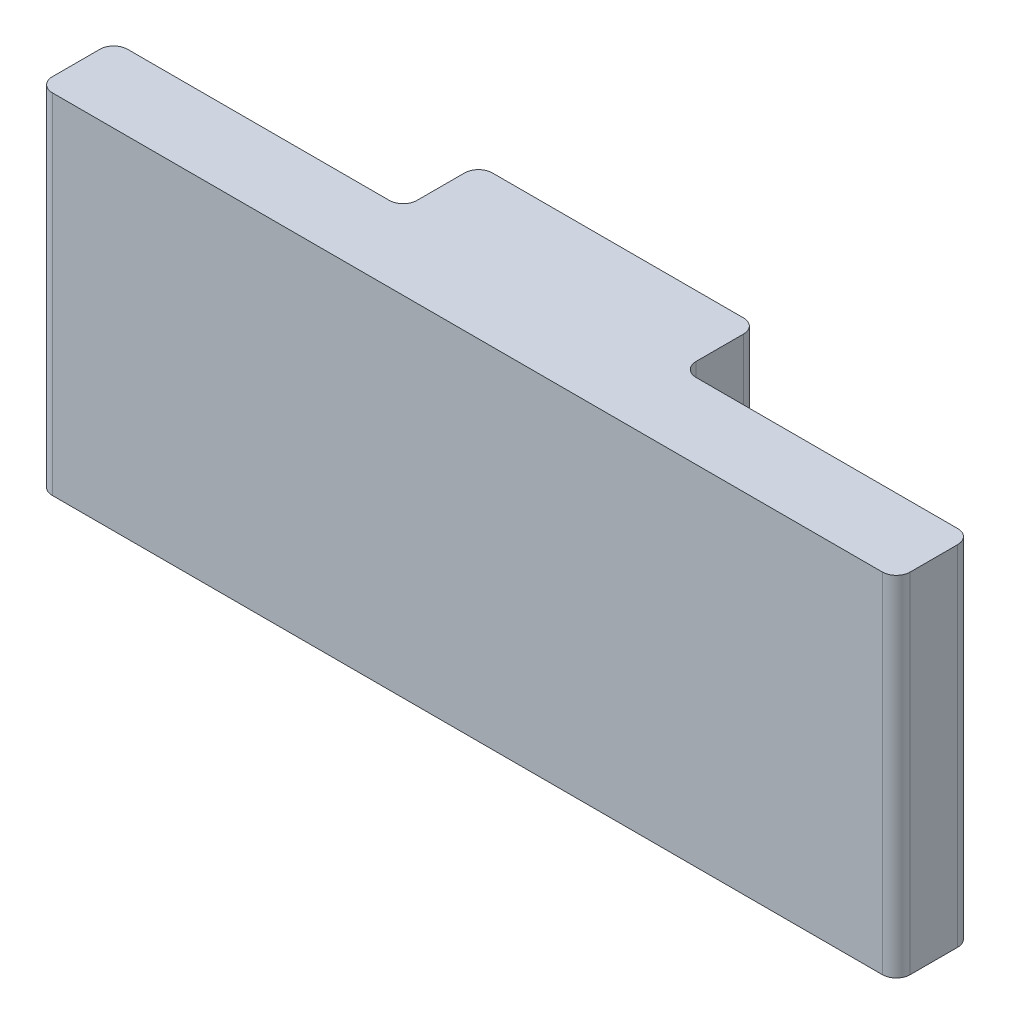
from build123d import *

# Parameters (mm, degrees)
EXTRUDE_1_DEPTH = 250


with BuildPart() as part:
    # 草图1 → 凸台-拉伸1 (new body)
    with BuildSketch(Plane(origin=(0, 0, 0), x_dir=(1, 0, 0), z_dir=(0, 1, 0))):
        with BuildLine():
            Line((-297.5, 0), (297.5, 0))
            ThreePointArc((297.5, 0), (304.571067812, 2.928932188), (307.5, 10))
            Line((307.5, 10), (307.5, 44))
            ThreePointArc((307.5, 44), (304.571067812, 51.071067812), (297.5, 54))
            Line((297.5, 54), (110, 54))
            ThreePointArc((110, 54), (102.928932188, 56.928932188), (100, 64))
            Line((100, 64), (100, 98))
            ThreePointArc((100, 98), (97.071067812, 105.071067812), (90, 108))
            Line((90, 108), (-90, 108))
            ThreePointArc((-90, 108), (-97.071067812, 105.071067812), (-100, 98))
            Line((-100, 98), (-100, 64))
            ThreePointArc((-100, 64), (-102.928932188, 56.928932188), (-110, 54))
            Line((-110, 54), (-297.5, 54))
            ThreePointArc((-297.5, 54), (-304.571067812, 51.071067812), (-307.5, 44))
            Line((-307.5, 44), (-307.5, 10))
            ThreePointArc((-307.5, 10), (-304.571067812, 2.928932188), (-297.5, 0))
        make_face()
    extrude(amount=EXTRUDE_1_DEPTH)


solid = part.part
